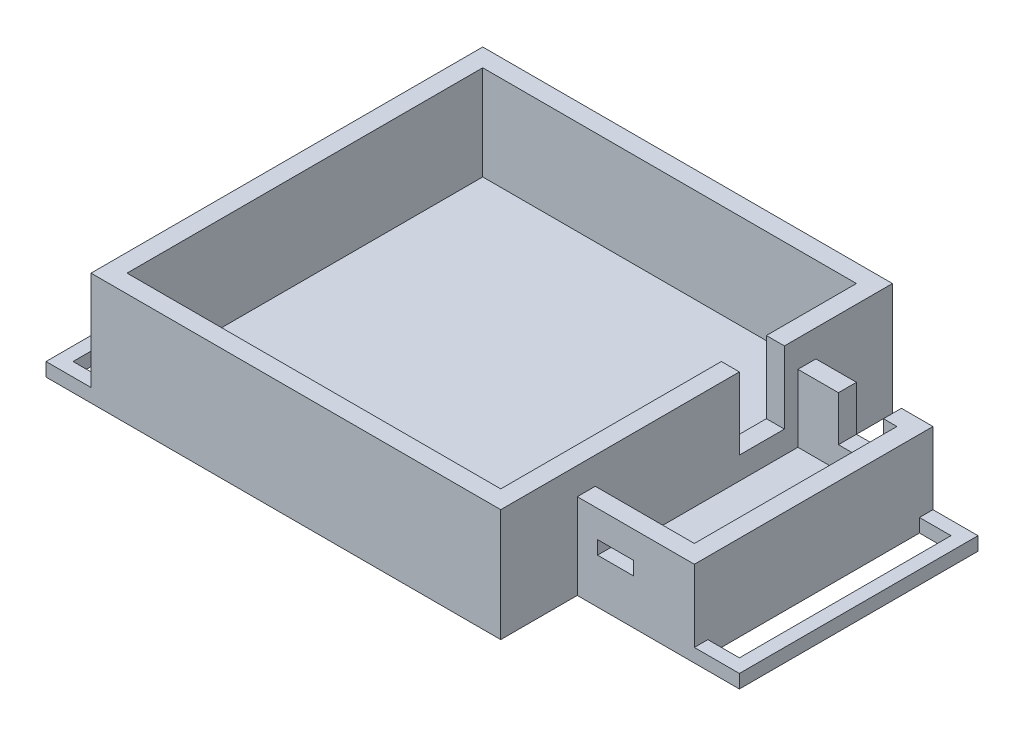
from build123d import *

# Parameters (mm, degrees)
SKETCH1_W           = 83
SKETCH1_H           = 79
BOSS_EXTRUDE1_DEPTH = 10.5
SHELL1_T            = 4
SKETCH4_W           = 53
SKETCH4_H           = 19
BOSS_EXTRUDE2_DEPTH = 26
SKETCH5_W           = 22
SKETCH5_H           = 45
CUT_EXTRUDE1_DEPTH  = 15
SKETCH7_W           = 8
SKETCH7_H           = 3
CUT_EXTRUDE2_DEPTH  = 4
SKETCH8_W           = 10
SKETCH8_H           = 10
CUT_EXTRUDE3_DEPTH  = 4
SKETCH9_W           = 53
SKETCH9_H           = 3
BOSS_EXTRUDE4_DEPTH = 10
SKETCH10_W          = 87
SKETCH10_H          = 3
BOSS_EXTRUDE5_DEPTH = 10
SKETCH11_W          = 7
SKETCH11_H          = 47
SKETCH11_H_2        = 81
CUT_EXTRUDE4_DEPTH  = 3
SKETCH12_W          = 10
SKETCH12_H          = 16
CUT_EXTRUDE5_DEPTH  = 4


with BuildPart() as part:
    # Sketch1 → Boss-Extrude1 (new, symmetric)
    with BuildSketch(Plane(origin=(0, 0, 0), x_dir=(1, 0, 0), z_dir=(0, 1, 0))):
        Rectangle(SKETCH1_W, SKETCH1_H)
    extrude(amount=BOSS_EXTRUDE1_DEPTH, both=True)

    # Shell1
    shell1_openings = [part.faces().sort_by_distance(p)[0] for p in [
        (0, 10.5, 0),
    ]]
    offset(amount=SHELL1_T, openings=shell1_openings, kind=Kind.INTERSECTION)

    # Sketch4 → Boss-Extrude2 (add)
    with BuildSketch(Plane(origin=(45.5, 0, 0), x_dir=(0, 0, -1), z_dir=(1, 0, 0))):
        with Locations((0, -5)):
            Rectangle(SKETCH4_W, SKETCH4_H)
    extrude(amount=BOSS_EXTRUDE2_DEPTH)

    # Sketch5 → Cut-Extrude1 (cut)
    with BuildSketch(Plane(origin=(0, 4.5, 0), x_dir=(1, 0, 0), z_dir=(0, 1, 0))):
        with Locations((56.5, 0)):
            Rectangle(SKETCH5_W, SKETCH5_H)
    extrude(amount=-CUT_EXTRUDE1_DEPTH, mode=Mode.SUBTRACT)

    # Sketch7 → Cut-Extrude2 (cut)
    with BuildSketch(Plane(origin=(0, 0, 22.5), x_dir=(-1, 0, 0), z_dir=(0, 0, -1))):
        with Locations((-54, -3)):
            Rectangle(SKETCH7_W, SKETCH7_H)
    extrude(amount=-CUT_EXTRUDE2_DEPTH, mode=Mode.SUBTRACT)

    # Sketch8 → Cut-Extrude3 (cut)
    with BuildSketch(Plane.XY.offset(-22.5)):
        with Locations((59.5, -0.5)):
            Rectangle(SKETCH8_W, SKETCH8_H)
    extrude(amount=-CUT_EXTRUDE3_DEPTH, mode=Mode.SUBTRACT)

    # Sketch9 → Boss-Extrude4 (add)
    with BuildSketch(Plane(origin=(71.5, 0, 0), x_dir=(0, 0, -1), z_dir=(1, 0, 0))):
        with Locations((0, -13)):
            Rectangle(SKETCH9_W, SKETCH9_H)
    extrude(amount=BOSS_EXTRUDE4_DEPTH)

    # Sketch10 → Boss-Extrude5 (add)
    with BuildSketch(Plane.ZY.offset(45.5)):
        with Locations((0, -13)):
            Rectangle(SKETCH10_W, SKETCH10_H)
    extrude(amount=BOSS_EXTRUDE5_DEPTH)

    # Sketch11 → Cut-Extrude4 (cut)
    with BuildSketch(Plane(origin=(0, -11.5, 0), x_dir=(1, 0, 0), z_dir=(0, 1, 0))):
        with Locations((75, 0)):
            Rectangle(SKETCH11_W, SKETCH11_H)
        with Locations((-49, 0)):
            Rectangle(SKETCH11_W, SKETCH11_H_2)
    extrude(amount=-CUT_EXTRUDE4_DEPTH, mode=Mode.SUBTRACT)

    # Sketch12 → Cut-Extrude5 (cut)
    with BuildSketch(Plane(origin=(45.5, 0, 0), x_dir=(0, 0, -1), z_dir=(1, 0, 0))):
        with Locations((14.5, 2.5)):
            Rectangle(SKETCH12_W, SKETCH12_H)
    extrude(amount=-CUT_EXTRUDE5_DEPTH, mode=Mode.SUBTRACT)


solid = part.part
